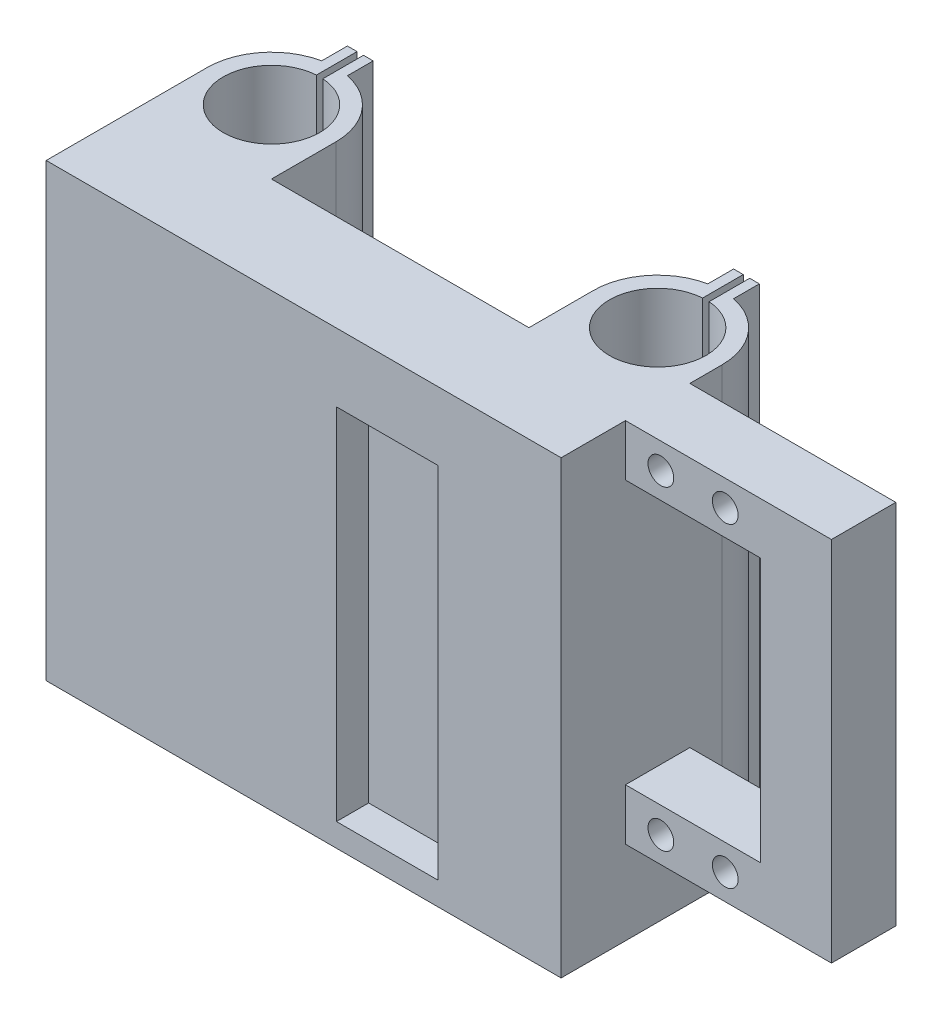
from build123d import *

# Parameters (mm, degrees)
SALIENTE_EXTRUIR1_DEPTH    = 70
SALIENTE_EXTRUIR2_START    = -70
SALIENTE_EXTRUIR2_DEPTH    = 70
CORTAR_EXTRUIR2_DEPTH      = 85.409715081
CORTAR_EXTRUIR2_DEPTH_BACK = 85.409715081
CORTAR_EXTRUIR3_START      = -30
CORTAR_EXTRUIR3_DEPTH      = 30
CORTAR_EXTRUIR6_DEPTH      = 30
CORTAR_EXTRUIR4_DEPTH      = 85.409715081
CORTAR_EXTRUIR4_DEPTH_BACK = 85.409715081
CROQUIS6_R                 = 5
CROQUIS6_R_2               = 1.6
CROQUIS7_W                 = 10
CROQUIS7_H                 = 8
SALIENTE_EXTRUIR3_DEPTH    = 32
CORTAR_EXTRUIR5_DEPTH      = 105.466848526
CORTAR_EXTRUIR5_DEPTH_BACK = 105.466848526
CROQUIS8_R                 = 2
SALIENTE_EXTRUIR4_REACH    = 100.25
CROQUIS10_W                = 11
CROQUIS10_H                = 10
CROQUIS12_W                = 15.8
CROQUIS12_H                = 55.8
CORTAR_EXTRUIR7_DEPTH      = 5


with BuildPart() as part:
    # Croquis1 → Saliente-Extruir1 (new body)
    with BuildSketch(Plane(origin=(0, 0, 0), x_dir=(1, 0, 0), z_dir=(0, 1, 0))):
        with BuildLine():
            Line((40, -25), (40, 0))
            ThreePointArc((40, 0), (32.043096437, 9.789063129), (20.83484861, 4))
            Line((20.83484861, 4), (11.313708499, 4))
            ThreePointArc((11.313708499, 4), (0, 12), (-11.313708499, 4))
            Line((-11.313708499, 4), (-20.83484861, 4))
            ThreePointArc((-20.83484861, 4), (-32.043096437, 9.789063129), (-40, 0))
            Line((-40, 0), (-40, -25))
            Line((-40, -25), (40, -25))
        make_face()
    extrude(amount=SALIENTE_EXTRUIR1_DEPTH)

    # Croquis3 → Saliente-Extruir2 (add)
    with BuildSketch(Plane(origin=(0, 70, 0), x_dir=(1, 0, 0), z_dir=(0, 1, 0)).offset(SALIENTE_EXTRUIR2_START)):
        with BuildLine():
            Line((-32, 9.797958971), (-32, 13.797958971))
            Line((-32, 13.797958971), (-28, 13.797958971))
            Line((-28, 13.797958971), (-28, 9.797958971))
            ThreePointArc((-28, 9.797958971), (-30, 10), (-32, 9.797958971))
        make_face()
        with BuildLine():
            Line((28, 9.797958971), (28, 13.797958971))
            Line((28, 13.797958971), (32, 13.797958971))
            Line((32, 13.797958971), (32, 9.797958971))
            ThreePointArc((32, 9.797958971), (30, 10), (28, 9.797958971))
        make_face()
    extrude(amount=SALIENTE_EXTRUIR2_DEPTH)

    # Croquis4 → Cortar-Extruir2 (cut, two sides: drawn at the far end of the back side and taken through both)
    with BuildSketch(Plane(origin=(0, 70, 0), x_dir=(1, 0, 0), z_dir=(0, 1, 0)).offset(-CORTAR_EXTRUIR2_DEPTH_BACK)):
        with BuildLine():
            Line((-30.5, 7.483314774), (-30.5, 14.654769407))
            Line((-30.5, 14.654769407), (-29.5, 14.654769407))
            Line((-29.5, 14.654769407), (-29.5, 7.483314774))
            ThreePointArc((-29.5, 7.483314774), (-30, -7.5), (-30.5, 7.483314774))
        make_face()
        with BuildLine():
            Line((29.5, 7.483314774), (29.5, 14.654769407))
            Line((29.5, 14.654769407), (30.5, 14.654769407))
            Line((30.5, 14.654769407), (30.5, 7.483314774))
            ThreePointArc((30.5, 7.483314774), (30, -7.5), (29.5, 7.483314774))
        make_face()
    extrude(amount=CORTAR_EXTRUIR2_DEPTH + CORTAR_EXTRUIR2_DEPTH_BACK, mode=Mode.SUBTRACT)

    # Croquis5 → Cortar-Extruir3 (cut)
    with BuildSketch(Plane(origin=(0, 70, 0), x_dir=(1, 0, 0), z_dir=(0, 1, 0)).offset(CORTAR_EXTRUIR3_START)):
        with BuildLine():
            Line((-20, 0), (-20, -10))
            Line((-20, -10), (20, -10))
            Line((20, -10), (20, 0))
            ThreePointArc((20, 0), (20.210936871, 2.043096437), (20.83484861, 4))
            Line((20.83484861, 4), (20.83484861, 13.99599321))
            Line((20.83484861, 13.99599321), (-20.83484861, 13.99599321))
            Line((-20.83484861, 13.99599321), (-20.83484861, 4))
            ThreePointArc((-20.83484861, 4), (-20.210936871, 2.043096437), (-20, 0))
        make_face()
    extrude(amount=CORTAR_EXTRUIR3_DEPTH, mode=Mode.SUBTRACT)

    # Croquis9 → Cortar-Extruir6 (cut)
    with BuildSketch(Plane(origin=(0, 0, 0), x_dir=(1, 0, 0), z_dir=(0, 1, 0))):
        with BuildLine():
            Line((-20, 0), (-20, -10))
            Line((-20, -10), (20, -10))
            Line((20, -10), (20, 0))
            ThreePointArc((20, 0), (20.210936871, 2.043096437), (20.83484861, 4))
            Line((20.83484861, 4), (20.83484861, 13.99599321))
            Line((20.83484861, 13.99599321), (-20.83484861, 13.99599321))
            Line((-20.83484861, 13.99599321), (-20.83484861, 4))
            ThreePointArc((-20.83484861, 4), (-20.210936871, 2.043096437), (-20, 0))
        make_face()
    extrude(amount=CORTAR_EXTRUIR6_DEPTH, mode=Mode.SUBTRACT)

    # Croquis6 → Cortar-Extruir4 (cut, two sides: drawn at the far end of the back side and taken through both)
    with BuildSketch(Plane(origin=(0, 70, 0), x_dir=(1, 0, 0), z_dir=(0, 1, 0)).offset(-CORTAR_EXTRUIR4_DEPTH_BACK)):
        with Locations(Location((0, 0, 0), (0, 0, 270))):
            Circle(CROQUIS6_R)
        with Locations(Location((-6.01040764, 6.01040764, 0), (0, 0, 270))):
            Circle(CROQUIS6_R_2)
        with Locations(Location((6.01040764, 6.01040764, 0), (0, 0, 270))):
            Circle(CROQUIS6_R_2)
        with Locations(Location((6.01040764, -6.01040764, 0), (0, 0, 270))):
            Circle(CROQUIS6_R_2)
        with Locations(Location((-6.01040764, -6.01040764, 0), (0, 0, 270))):
            Circle(CROQUIS6_R_2)
    extrude(amount=CORTAR_EXTRUIR4_DEPTH + CORTAR_EXTRUIR4_DEPTH_BACK, mode=Mode.SUBTRACT)

    # Croquis7 → Saliente-Extruir3 (add)
    with BuildSketch(Plane(origin=(40, 0, 0), x_dir=(0, 0, -1), z_dir=(1, 0, 0))):
        with Locations((-10, 66)):
            Rectangle(CROQUIS7_W, CROQUIS7_H)
        with Locations((-10, 17)):
            Rectangle(CROQUIS7_W, CROQUIS7_H)
    extrude(amount=SALIENTE_EXTRUIR3_DEPTH)

    # Croquis8 → Cortar-Extruir5 (cut, two sides: drawn at the far end of the back side and taken through both)
    with BuildSketch(Plane.XY.offset(15).offset(-CORTAR_EXTRUIR5_DEPTH_BACK)):
        with Locations((45.5, 66)):
            Circle(CROQUIS8_R)
        with Locations((55.5, 66)):
            Circle(CROQUIS8_R)
        with Locations((45.5, 17)):
            Circle(CROQUIS8_R)
        with Locations((55.5, 17)):
            Circle(CROQUIS8_R)
    extrude(amount=CORTAR_EXTRUIR5_DEPTH + CORTAR_EXTRUIR5_DEPTH_BACK, mode=Mode.SUBTRACT)

    # Croquis10 → Saliente-Extruir4 (add, up to next)
    with BuildSketch(Plane.XZ.offset(-62), mode=Mode.PRIVATE) as saliente_extruir4_sk1:
        with Locations((66.5, 10)):
            Rectangle(CROQUIS10_W, CROQUIS10_H)
    saliente_extruir4_tool1 = extrude(saliente_extruir4_sk1.sketch, amount=SALIENTE_EXTRUIR4_REACH, mode=Mode.PRIVATE) - part.part
    add(saliente_extruir4_tool1.solids().sort_by_distance((66.5, 62, 10))[0])

    # Croquis12 → Cortar-Extruir7 (cut)
    with BuildSketch(Plane.XY.offset(25)):
        with Locations((13, 31.5)):
            Rectangle(CROQUIS12_W, CROQUIS12_H)
    extrude(amount=-CORTAR_EXTRUIR7_DEPTH, mode=Mode.SUBTRACT)


solid = part.part
